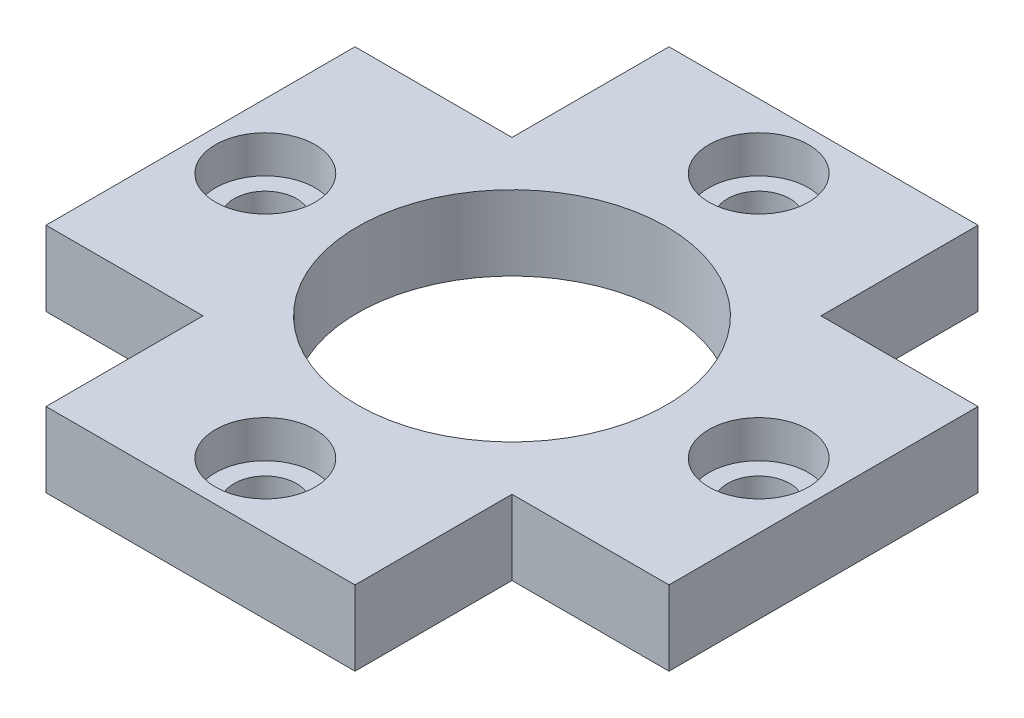
from build123d import *

# Parameters (mm, degrees)
EXTRUDE_1_DEPTH          = 3
SKETCH_2_R               = 1.25
CUT_EXTRUDE_1_DEPTH      = 18.930421077
CUT_EXTRUDE_START        = -3
SKETCH_2_3_R             = 2
CUT_EXTRUDE_2_DEPTH      = 1.5
PATTERN_CIRCULAR_1_COUNT = 4


with BuildPart() as part:
    # 草图1 → 凸台-拉伸1 (new body)
    with BuildSketch(Plane(origin=(0, 0, 0), x_dir=(1, 0, 0), z_dir=(0, 1, 0))):
        with BuildLine():
            ThreePointArc((0, 6.2), (4.384062043, 4.384062043), (6.2, 0))
            Line((6.2, 0), (6.2, 6.2))
            Line((6.2, 6.2), (0, 6.2))
        make_face()
        with BuildLine():
            Line((-6.2, 6.2), (-6.2, 1.3e-08))
            ThreePointArc((-6.2, 1.3e-08), (-4.384062039, 4.384062048), (0, 6.2))
            Line((0, 6.2), (-6.2, 6.2))
        make_face()
        with BuildLine():
            Line((-6.2, 1.3e-08), (-6.2, -6.2))
            Line((-6.2, -6.2), (0, -6.2))
            ThreePointArc((0, -6.2), (-4.384062048, -4.384062039), (-6.2, 1.3e-08))
        make_face()
        with BuildLine():
            ThreePointArc((6.2, 0), (4.384062043, -4.384062043), (0, -6.2))
            Line((0, -6.2), (6.2, -6.2))
            Line((6.2, -6.2), (6.2, 0))
        make_face()
        Polygon((0, -6.2), (-6.2, -6.2), (-6.2, -12.5), (6.2, -12.5), (6.2, -6.2), align=None)
        Polygon((6.2, 0), (6.2, -6.2), (12.5, -6.2), (12.5, 6.2), (6.2, 6.2), align=None)
        Polygon((-6.2, 12.5), (-6.2, 6.2), (0, 6.2), (6.2, 6.2), (6.2, 12.5), align=None)
        Polygon((-12.5, 6.2), (-12.5, -6.2), (-6.2, -6.2), (-6.2, 1.3e-08), (-6.2, 6.2), align=None)
    extrude(amount=EXTRUDE_1_DEPTH)

    # 草图2 → 切除-拉伸1 (cut, through all)
    with BuildSketch(Plane(origin=(0, 0, 0), x_dir=(-1, 0, 0), z_dir=(0, -1, 0))):
        with Locations(Location((-9.899494937, 0, 0), (0, 0, 90))):
            Circle(SKETCH_2_R)
    cut_extrude_1 = extrude(amount=-CUT_EXTRUDE_1_DEPTH, mode=Mode.SUBTRACT)

    # 草图2<3> → 切除-拉伸2 (cut)
    with BuildSketch(Plane(origin=(0, 0, 0), x_dir=(-1, 0, 0), z_dir=(0, -1, 0)).offset(CUT_EXTRUDE_START)):
        with Locations(Location((-9.899494937, 0, 0), (0, 0, 270))):
            Circle(SKETCH_2_3_R)
    cut_extrude_2 = extrude(amount=CUT_EXTRUDE_2_DEPTH, mode=Mode.SUBTRACT)

    # 阵列(圆周)1: 切除-拉伸1, 切除-拉伸2 ×4 about axis
    pattern_circular_1_axis = Axis((0, 0, 0), (0, 1, 0))
    add([cut_extrude_1.rotate(pattern_circular_1_axis, i * 360 / PATTERN_CIRCULAR_1_COUNT) for i in range(1, PATTERN_CIRCULAR_1_COUNT)], mode=Mode.SUBTRACT)
    add([cut_extrude_2.rotate(pattern_circular_1_axis, i * 360 / PATTERN_CIRCULAR_1_COUNT) for i in range(1, PATTERN_CIRCULAR_1_COUNT)], mode=Mode.SUBTRACT)


solid = part.part
